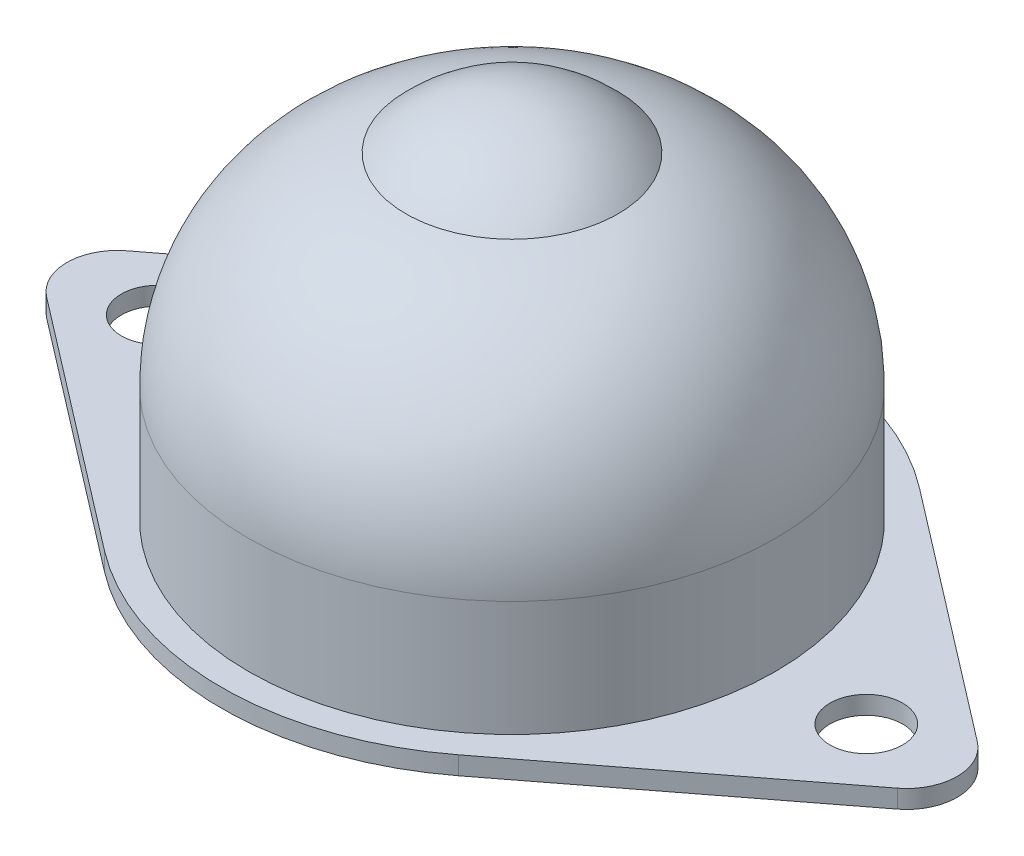
from build123d import *

# Parameters (mm, degrees)
SKETCH1_R           = 2
BOSS_EXTRUDE1_DEPTH = 1


with BuildPart() as part:
    # Sketch1 → Boss-Extrude1 (new body)
    with BuildSketch(Plane(origin=(0, 0, 0), x_dir=(1, 0, 0), z_dir=(0, 1, 0))):
        with BuildLine():
            Line((-23.414655011, 2.20086192), (-9.740182864, 12.693653445))
            ThreePointArc((-9.740182864, 12.693653445), (0, 16), (9.740182864, 12.693653445))
            Line((9.740182864, 12.693653445), (23.414655011, 2.20086192))
            ThreePointArc((23.414655011, 2.20086192), (24.5, 0), (23.414655011, -2.20086192))
            Line((23.414655011, -2.20086192), (9.740182864, -12.693653445))
            ThreePointArc((9.740182864, -12.693653445), (0, -16), (-9.740182864, -12.693653445))
            Line((-9.740182864, -12.693653445), (-23.414655011, -2.20086192))
            ThreePointArc((-23.414655011, -2.20086192), (-24.5, 0), (-23.414655011, 2.20086192))
        make_face()
        with Locations(Location((-19.5, 0, 0), (0, 0, 270))):
            Circle(SKETCH1_R, mode=Mode.SUBTRACT)
        with Locations(Location((19.5, 0, 0), (0, 0, 90))):
            Circle(SKETCH1_R, mode=Mode.SUBTRACT)
    extrude(amount=BOSS_EXTRUDE1_DEPTH)

    # Sketch2 → Revolve1 (revolve)
    with BuildSketch(Plane.XY, mode=Mode.PRIVATE) as revolve1_sk:
        with BuildLine():
            Line((0, 6.082034509), (0, 1))
            Line((0, 1), (-14.5, 1))
            Line((-14.5, 1), (-14.5, 7.345083381))
            ThreePointArc((-14.5, 7.345083381), (-12.078795143, 14.399662879), (-5.835769403, 18.480588566))
            ThreePointArc((-5.835769403, 18.480588566), (-3.178192824, 20.343251845), (0, 21))
            Line((0, 21), (0, 6.082034509))
        make_face()
    revolve(revolve1_sk.sketch.rotate(Axis((0, 0, 0), (0, 1, 0)), 270), axis=Axis((0, 0, 0), (0, 1, 0)))


solid = part.part
